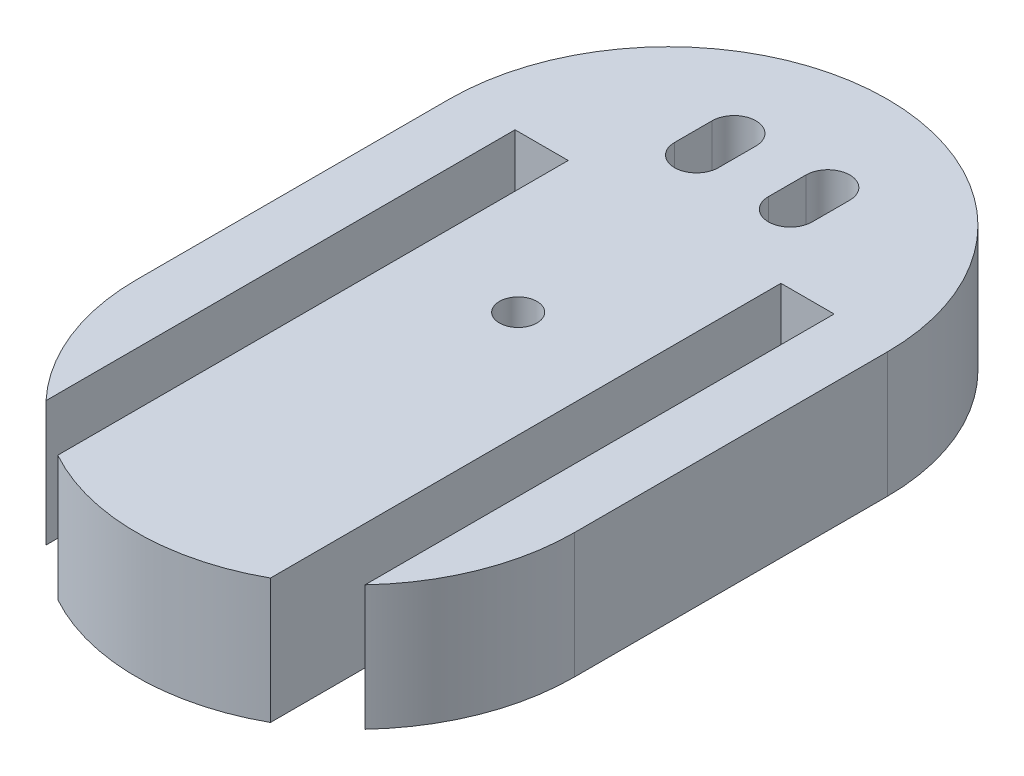
from build123d import *

# Parameters (mm, degrees)
EXTRUDE_1_DEPTH     = 4
SKETCH_2_W          = 1.7
SKETCH_2_H          = 55.892000818
CUT_EXTRUDE_1_DEPTH = 19.814887722
CUT_EXTRUDE_2_DEPTH = 19.814887722
SKETCH_4_R          = 0.6
CUT_EXTRUDE_3_DEPTH = 19.814887722


with BuildPart() as part:
    # 草图1 → 凸台-拉伸1 (new body)
    with BuildSketch(Plane(origin=(0, 0, 0), x_dir=(1, 0, 0), z_dir=(0, 1, 0))):
        with BuildLine():
            Line((7, 0), (7, -10))
            ThreePointArc((7, -10), (0, -17), (-7, -10))
            Line((-7, -10), (-7, 0))
            ThreePointArc((-7, 0), (0, 7), (7, 0))
        make_face()
    extrude(amount=EXTRUDE_1_DEPTH)

    # 草图2 → 切除-拉伸1 (cut, through all)
    with BuildSketch(Plane(origin=(0, 4, 0), x_dir=(1, 0, 0), z_dir=(0, 1, 0))):
        with Locations((-4.25, -27.746000409)):
            Rectangle(SKETCH_2_W, SKETCH_2_H)
        with Locations((4.25, -27.746000409)):
            Rectangle(SKETCH_2_W, SKETCH_2_H)
    extrude(amount=-CUT_EXTRUDE_1_DEPTH, mode=Mode.SUBTRACT)

    # 草图3 → 切除-拉伸2 (cut, through all)
    with BuildSketch(Plane(origin=(0, 4, 0), x_dir=(1, 0, 0), z_dir=(0, 1, 0))):
        with BuildLine():
            Line((-2.2, 2.4), (-2.2, 3.6))
            ThreePointArc((-2.2, 3.6), (-1.5, 4.3), (-0.8, 3.6))
            Line((-0.8, 3.6), (-0.8, 2.4))
            ThreePointArc((-0.8, 2.4), (-1.5, 1.7), (-2.2, 2.4))
        make_face()
        with BuildLine():
            Line((2.2, 2.4), (2.2, 3.6))
            ThreePointArc((2.2, 3.6), (1.5, 4.3), (0.8, 3.6))
            Line((0.8, 3.6), (0.8, 2.4))
            ThreePointArc((0.8, 2.4), (1.5, 1.7), (2.2, 2.4))
        make_face()
    extrude(amount=-CUT_EXTRUDE_2_DEPTH, mode=Mode.SUBTRACT)

    # 草图4 → 切除-拉伸3 (cut, through all)
    with BuildSketch(Plane(origin=(0, 4, 0), x_dir=(1, 0, 0), z_dir=(0, 1, 0))):
        with Locations(Location((0, -4.8, 0), (0, 0, 270))):
            Circle(SKETCH_4_R)
    extrude(amount=-CUT_EXTRUDE_3_DEPTH, mode=Mode.SUBTRACT)


solid = part.part
